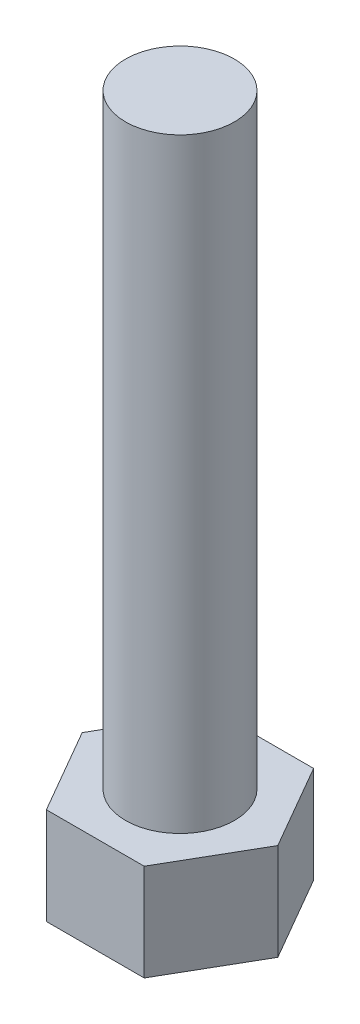
from build123d import *

# Parameters (mm, degrees)
BOSS_EXTRUDE2_DEPTH = 4
SKETCH2_R           = 2.25
BOSS_EXTRUDE3_DEPTH = 25


with BuildPart() as part:
    # Sketch1 → Boss-Extrude2 (new body)
    with BuildSketch(Plane(origin=(0, 0, 0), x_dir=(1, 0, 0), z_dir=(0, 1, 0))):
        Polygon((2.020725942, -3.5), (4.041451884, 0), (2.020725942, 3.5), (-2.020725942, 3.5), (-4.041451884, 0), (-2.020725942, -3.5), align=None)
    extrude(amount=BOSS_EXTRUDE2_DEPTH)

    # Sketch2 → Boss-Extrude3 (add)
    with BuildSketch(Plane(origin=(0, 4, 0), x_dir=(1, 0, 0), z_dir=(0, 1, 0))):
        with Locations(Location((0, 0, 0), (0, 0, 270))):
            Circle(SKETCH2_R)
    extrude(amount=BOSS_EXTRUDE3_DEPTH)


solid = part.part
